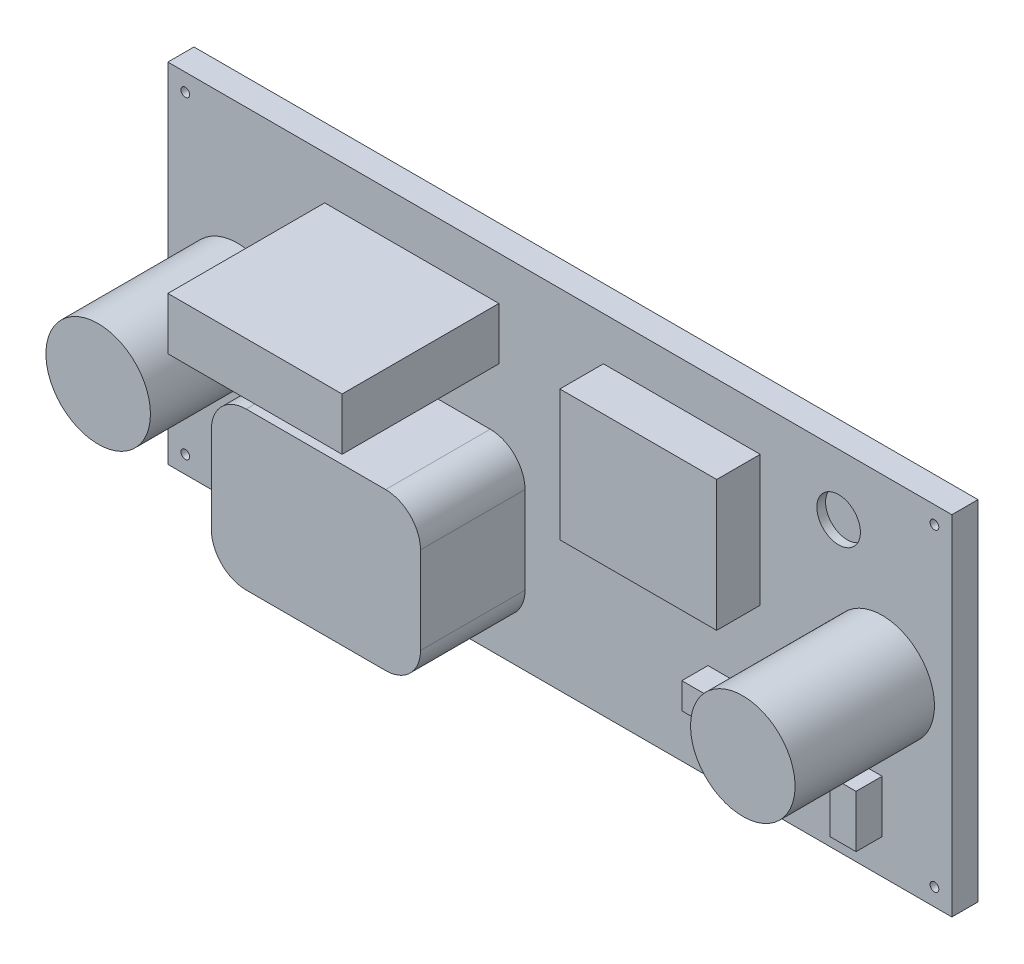
from build123d import *

# Parameters (mm, degrees)
SKETCH1_W           = 45
SKETCH1_H           = 20
BOSS_EXTRUDE1_DEPTH = 1.5
SKETCH2_R           = 3
BOSS_EXTRUDE3_DEPTH = 8
SKETCH3_W           = 10
SKETCH3_H           = 3
BOSS_EXTRUDE4_DEPTH = 9
BOSS_EXTRUDE5_DEPTH = 6
SKETCH6_W           = 9
SKETCH6_H           = 7.5
BOSS_EXTRUDE6_DEPTH = 2.5
SKETCH7_W           = 1.5
SKETCH7_H           = 3
SKETCH7_W_2         = 3
SKETCH7_H_2         = 1.5
BOSS_EXTRUDE7_DEPTH = 1.5
SKETCH9_R           = 1.25
CUT_EXTRUDE1_DEPTH  = 0.5
SKETCH10_R          = 1.25
CUT_EXTRUDE2_DEPTH  = 0.5
SKETCH12_R          = 0.25
CUT_EXTRUDE3_DEPTH  = 1.5


with BuildPart() as part:
    # Sketch1 → Boss-Extrude1 (new body)
    with BuildSketch(Plane.XY):
        Rectangle(SKETCH1_W, SKETCH1_H)
    extrude(amount=BOSS_EXTRUDE1_DEPTH)

    # Sketch2 → Boss-Extrude3 (add)
    with BuildSketch(Plane.XY.offset(1.5)):
        with Locations((-18.5, 0)):
            Circle(SKETCH2_R)
        with Locations(Location((18.5, 0, 0), (0, 0, 180))):
            Circle(SKETCH2_R)
    extrude(amount=BOSS_EXTRUDE3_DEPTH)

    # Sketch3 → Boss-Extrude4 (add)
    with BuildSketch(Plane.XY.offset(1.5)):
        with Locations((-8.5, 6)):
            Rectangle(SKETCH3_W, SKETCH3_H)
    extrude(amount=BOSS_EXTRUDE4_DEPTH)

    # Sketch5 → Boss-Extrude5 (add)
    with BuildSketch(Plane.XY.offset(1.5)):
        with BuildLine():
            Line((-12, 1), (-4, 1))
            ThreePointArc((-4, 1), (-2.585786438, 0.414213562), (-2, -1))
            Line((-2, -1), (-2, -6))
            ThreePointArc((-2, -6), (-2.585786438, -7.414213562), (-4, -8))
            Line((-4, -8), (-12, -8))
            ThreePointArc((-12, -8), (-13.414213562, -7.414213562), (-14, -6))
            Line((-14, -6), (-14, -1))
            ThreePointArc((-14, -1), (-13.414213562, 0.414213562), (-12, 1))
        make_face()
    extrude(amount=BOSS_EXTRUDE5_DEPTH)

    # Sketch6 → Boss-Extrude6 (add)
    with BuildSketch(Plane.XY.offset(1.5)):
        with Locations((7, 3.75)):
            Rectangle(SKETCH6_W, SKETCH6_H)
    extrude(amount=BOSS_EXTRUDE6_DEPTH)

    # Sketch7 → Boss-Extrude7 (add)
    with BuildSketch(Plane.XY.offset(1.5)):
        with Locations((17.75, -6.5)):
            Rectangle(SKETCH7_W, SKETCH7_H)
        with Locations((10, -5.25)):
            Rectangle(SKETCH7_W_2, SKETCH7_H_2)
    extrude(amount=BOSS_EXTRUDE7_DEPTH)

    # Sketch9 → Cut-Extrude1 (cut)
    with BuildSketch(Plane.XY.offset(1.5)):
        with Locations((-17.5, -7)):
            Circle(SKETCH9_R)
    extrude(amount=-CUT_EXTRUDE1_DEPTH, mode=Mode.SUBTRACT)

    # Sketch10 → Cut-Extrude2 (cut)
    with BuildSketch(Plane.XY.offset(1.5)):
        with Locations((16, 6.5)):
            Circle(SKETCH10_R)
    extrude(amount=-CUT_EXTRUDE2_DEPTH, mode=Mode.SUBTRACT)

    # Sketch12 → Cut-Extrude3 (cut)
    with BuildSketch(Plane.XY.offset(1.5)):
        with Locations((-21.5, 9)):
            Circle(SKETCH12_R)
        with Locations((21.5, 9)):
            Circle(SKETCH12_R)
        with Locations((21.5, -9)):
            Circle(SKETCH12_R)
        with Locations((-21.5, -9)):
            Circle(SKETCH12_R)
    extrude(amount=-CUT_EXTRUDE3_DEPTH, mode=Mode.SUBTRACT)


solid = part.part
